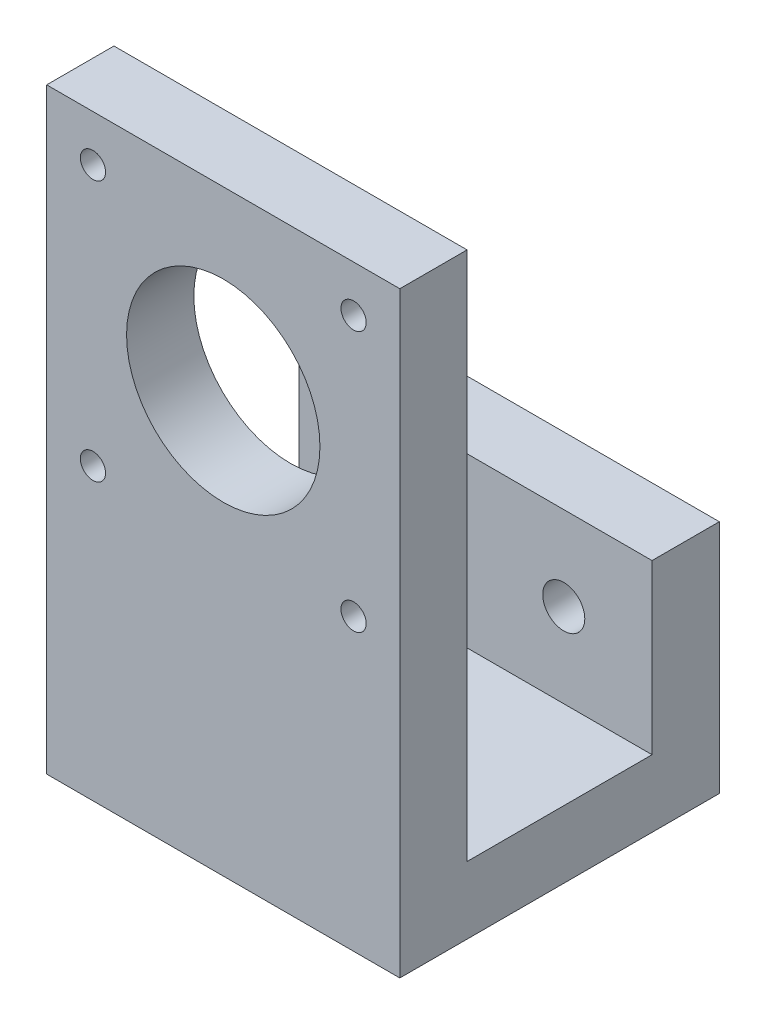
from build123d import *

# Parameters (mm, degrees)
SKETCH_1_W      = 42
SKETCH_1_H      = 20
SKETCH_1_R      = 2.5
EXTRUDE_1_DEPTH = 8
SKETCH_1_3_W    = 42
SKETCH_1_3_H    = 8
EXTRUDE_2_DEPTH = 30
SKETCH_2_W      = 42
SKETCH_2_H      = 71
SKETCH_2_R      = 1.5
SKETCH_2_R_2    = 11.5
EXTRUDE_3_DEPTH = 8


with BuildPart() as part:
    # 草图1 → 凸台-拉伸1 (new body)
    with BuildSketch(Plane.XY):
        with Locations((8.76, 8.6)):
            Rectangle(SKETCH_1_W, SKETCH_1_H)
        with Locations((-1.74, 8.6)):
            Circle(SKETCH_1_R, mode=Mode.SUBTRACT)
        with Locations((19.26, 8.6)):
            Circle(SKETCH_1_R, mode=Mode.SUBTRACT)
    extrude(amount=EXTRUDE_1_DEPTH)

    # 草图1<3> → 凸台-拉伸2 (add)
    with BuildSketch(Plane.XY):
        with Locations((8.76, -5.4)):
            Rectangle(SKETCH_1_3_W, SKETCH_1_3_H)
    extrude(amount=EXTRUDE_2_DEPTH)

    # 草图2 → 凸台-拉伸3 (add)
    with BuildSketch(Plane.XY.offset(30)):
        with Locations((8.76, 26.1)):
            Rectangle(SKETCH_2_W, SKETCH_2_H)
        with Locations((24.26, 56.1)):
            Circle(SKETCH_2_R, mode=Mode.SUBTRACT)
        with Locations((-6.74, 56.1)):
            Circle(SKETCH_2_R, mode=Mode.SUBTRACT)
        with Locations((-6.74, 25.1)):
            Circle(SKETCH_2_R, mode=Mode.SUBTRACT)
        with Locations((24.26, 25.1)):
            Circle(SKETCH_2_R, mode=Mode.SUBTRACT)
        with Locations((8.76, 40.6)):
            Circle(SKETCH_2_R_2, mode=Mode.SUBTRACT)
    extrude(amount=EXTRUDE_3_DEPTH)


solid = part.part
